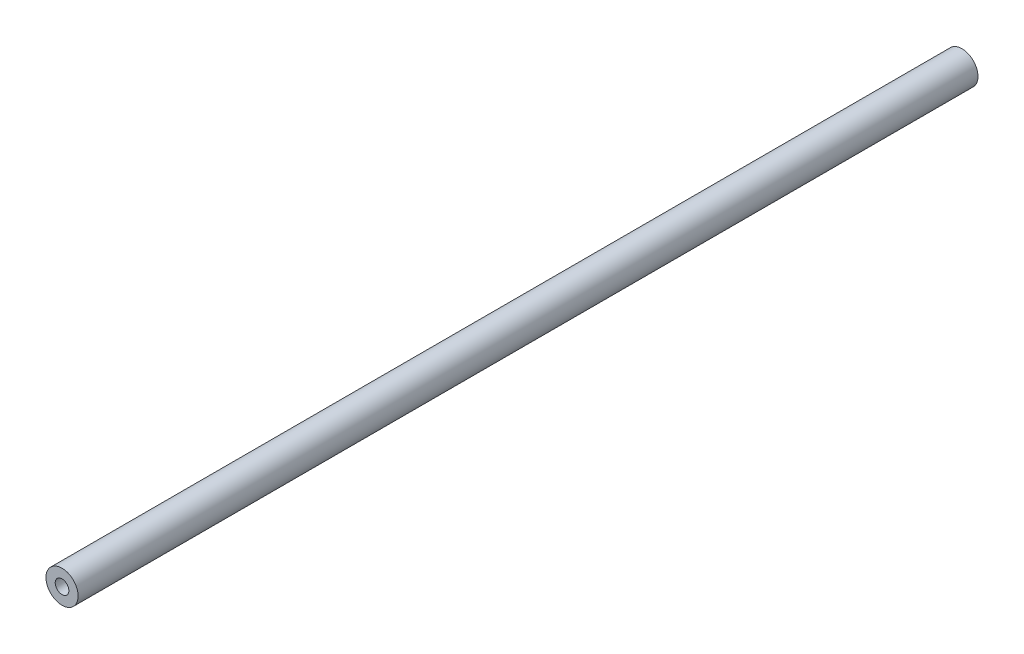
from build123d import *

# Parameters (mm, degrees)
SKETCH1_R                            = 4.7625
BOSS_EXTRUDE1_DEPTH                  = 133.35
F_10_32_TAPPED_HOLE1_D               = 4.0386
F_10_32_TAPPED_HOLE1_DEPTH           = 12.02944
F_10_32_TAPPED_HOLE1_TIP             = 1.213317848
F_10_32_TAPPED_HOLE1_ON_FACE_2_D     = 4.0386
F_10_32_TAPPED_HOLE1_ON_FACE_2_DEPTH = 12.02944
F_10_32_TAPPED_HOLE1_ON_FACE_2_TIP   = 1.213317848


with BuildPart() as part:
    # Sketch1 → Boss-Extrude1 (new, symmetric)
    with BuildSketch(Plane.XY):
        Circle(SKETCH1_R)
    extrude(amount=BOSS_EXTRUDE1_DEPTH, both=True)

    # #10-32 Tapped Hole1
    with Locations(Plane.XY.offset(133.35)):
        with Locations((0, 0)):
            Hole(F_10_32_TAPPED_HOLE1_D / 2, depth=F_10_32_TAPPED_HOLE1_DEPTH)
            with Locations((0, 0, -(F_10_32_TAPPED_HOLE1_DEPTH + F_10_32_TAPPED_HOLE1_TIP / 2))):  # 118° drill point
                Cone(0, F_10_32_TAPPED_HOLE1_D / 2, F_10_32_TAPPED_HOLE1_TIP, mode=Mode.SUBTRACT)

    # #10-32 Tapped Hole1 on face 2
    with Locations(Plane(origin=(0, 0, -133.35), x_dir=(-1, 0, 0), z_dir=(0, 0, -1))):
        with Locations((0, 0)):
            Hole(F_10_32_TAPPED_HOLE1_ON_FACE_2_D / 2, depth=F_10_32_TAPPED_HOLE1_ON_FACE_2_DEPTH)
            with Locations((0, 0, -(F_10_32_TAPPED_HOLE1_ON_FACE_2_DEPTH + F_10_32_TAPPED_HOLE1_ON_FACE_2_TIP / 2))):  # 118° drill point
                Cone(0, F_10_32_TAPPED_HOLE1_ON_FACE_2_D / 2, F_10_32_TAPPED_HOLE1_ON_FACE_2_TIP, mode=Mode.SUBTRACT)


solid = part.part
